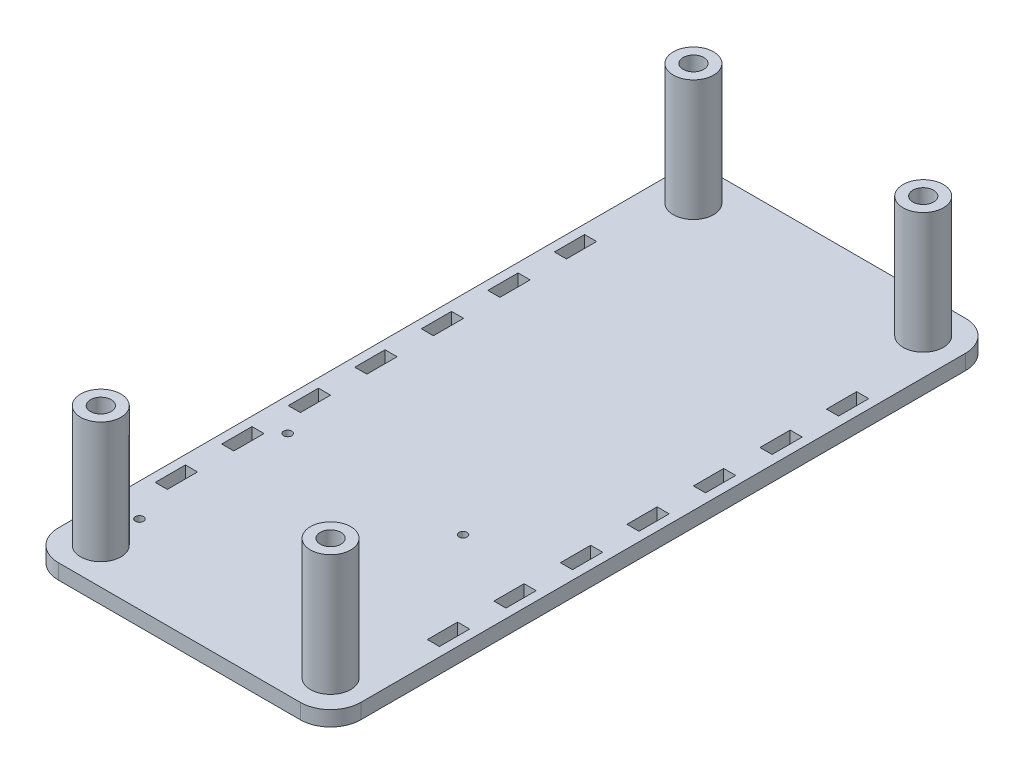
from build123d import *

# Parameters (mm, degrees)
SKETCH1_W           = 100
SKETCH1_H           = 220
BOSS_EXTRUDE1_DEPTH = 5
FILLET1_R           = 10
FILLET2_R           = 10
FILLET3_R           = 10
FILLET4_R           = 10
SKETCH2_R           = 6.668119003
BOSS_EXTRUDE2_DEPTH = 40
SKETCH4_R           = 3.418119003
CUT_EXTRUDE1_DEPTH  = 15
SKETCH5_R           = 3.418119003
CUT_EXTRUDE2_DEPTH  = 15
SKETCH6_R           = 3.418119003
CUT_EXTRUDE3_DEPTH  = 15
SKETCH7_R           = 3.418119003
CUT_EXTRUDE4_DEPTH  = 15
SKETCH8_W           = 4
SKETCH8_H           = 10
CUT_EXTRUDE5_DEPTH  = 157.908412776
SKETCH9_R           = 1.35
CUT_EXTRUDE7_DEPTH  = 159.256911381


with BuildPart() as part:
    # Sketch1 → Boss-Extrude1 (new body)
    with BuildSketch(Plane(origin=(0, 0, 0), x_dir=(1, 0, 0), z_dir=(0, 1, 0))):
        with Locations((-54.5, 0)):
            Rectangle(SKETCH1_W, SKETCH1_H)
    extrude(amount=BOSS_EXTRUDE1_DEPTH)

    # Fillet1
    fillet1_edges = [part.edges().sort_by_distance(p)[0] for p in [
        (-4.5, 2.5, 110),
    ]]
    fillet(fillet1_edges, radius=FILLET1_R)

    # Fillet2
    fillet2_edges = [part.edges().sort_by_distance(p)[0] for p in [
        (-4.5, 2.5, -110),
    ]]
    fillet(fillet2_edges, radius=FILLET2_R)

    # Fillet3
    fillet3_edges = [part.edges().sort_by_distance(p)[0] for p in [
        (-104.5, 2.5, 110),
    ]]
    fillet(fillet3_edges, radius=FILLET3_R)

    # Fillet4
    fillet4_edges = [part.edges().sort_by_distance(p)[0] for p in [
        (-104.5, 2.5, -110),
    ]]
    fillet(fillet4_edges, radius=FILLET4_R)

    # Sketch2 → Boss-Extrude2 (add)
    with BuildSketch(Plane(origin=(0, 5, 0), x_dir=(1, 0, 0), z_dir=(0, 1, 0))):
        with Locations(Location((-92.5, 98, 0), (0, 0, 270))):
            Circle(SKETCH2_R)
        with Locations(Location((-92.5, -98, 0), (0, 0, 90))):
            Circle(SKETCH2_R)
        with Locations(Location((-16.5, 98, 0), (0, 0, 90))):
            Circle(SKETCH2_R)
        with Locations(Location((-16.5, -98, 0), (0, 0, 270))):
            Circle(SKETCH2_R)
    extrude(amount=BOSS_EXTRUDE2_DEPTH)

    # Sketch4 → Cut-Extrude1 (cut)
    with BuildSketch(Plane(origin=(0, 45, 0), x_dir=(1, 0, 0), z_dir=(0, 1, 0))):
        with Locations(Location((-92.5, 98, 0), (0, 0, 270))):
            Circle(SKETCH4_R)
    extrude(amount=-CUT_EXTRUDE1_DEPTH, mode=Mode.SUBTRACT)

    # Sketch5 → Cut-Extrude2 (cut)
    with BuildSketch(Plane(origin=(0, 45, 0), x_dir=(1, 0, 0), z_dir=(0, 1, 0))):
        with Locations(Location((-92.5, -98, 0), (0, 0, 270))):
            Circle(SKETCH5_R)
    extrude(amount=-CUT_EXTRUDE2_DEPTH, mode=Mode.SUBTRACT)

    # Sketch6 → Cut-Extrude3 (cut)
    with BuildSketch(Plane(origin=(0, 45, 0), x_dir=(1, 0, 0), z_dir=(0, 1, 0))):
        with Locations(Location((-16.5, 98, 0), (0, 0, 270))):
            Circle(SKETCH6_R)
    extrude(amount=-CUT_EXTRUDE3_DEPTH, mode=Mode.SUBTRACT)

    # Sketch7 → Cut-Extrude4 (cut)
    with BuildSketch(Plane(origin=(0, 45, 0), x_dir=(1, 0, 0), z_dir=(0, 1, 0))):
        with Locations(Location((-16.5, -98, 0), (0, 0, 270))):
            Circle(SKETCH7_R)
    extrude(amount=-CUT_EXTRUDE4_DEPTH, mode=Mode.SUBTRACT)

    # Sketch8 → Cut-Extrude5 (cut, through all)
    with BuildSketch(Plane(origin=(0, 5, 0), x_dir=(1, 0, 0), z_dir=(0, 1, 0))):
        with Locations((-99.5, 66)):
            Rectangle(SKETCH8_W, SKETCH8_H)
        with Locations((-99.5, 44)):
            Rectangle(SKETCH8_W, SKETCH8_H)
        with Locations((-99.5, 22)):
            Rectangle(SKETCH8_W, SKETCH8_H)
        with Locations((-99.5, 0)):
            Rectangle(SKETCH8_W, SKETCH8_H)
        with Locations((-9.5, -66)):
            Rectangle(SKETCH8_W, SKETCH8_H)
        with Locations((-9.5, -44)):
            Rectangle(SKETCH8_W, SKETCH8_H)
        with Locations((-99.5, -22)):
            Rectangle(SKETCH8_W, SKETCH8_H)
        with Locations((-99.5, -44)):
            Rectangle(SKETCH8_W, SKETCH8_H)
        with Locations((-99.5, -66)):
            Rectangle(SKETCH8_W, SKETCH8_H)
        with Locations((-9.5, -22)):
            Rectangle(SKETCH8_W, SKETCH8_H)
        with Locations((-9.5, 0)):
            Rectangle(SKETCH8_W, SKETCH8_H)
        with Locations((-9.5, 22)):
            Rectangle(SKETCH8_W, SKETCH8_H)
        with Locations((-9.5, 44)):
            Rectangle(SKETCH8_W, SKETCH8_H)
        with Locations((-9.5, 66)):
            Rectangle(SKETCH8_W, SKETCH8_H)
    extrude(amount=-CUT_EXTRUDE5_DEPTH, mode=Mode.SUBTRACT)

    # Sketch9 → Cut-Extrude7 (cut, through all)
    with BuildSketch(Plane.XZ):
        with Locations(Location((-93.622758359, 35.073260268, 0), (0, 0, 270))):
            Circle(SKETCH9_R)
        with Locations(Location((-35.622758359, 35.073260268, 0), (0, 0, 270))):
            Circle(SKETCH9_R)
        with Locations(Location((-35.622758359, 84.073260268, 0), (0, 0, 270))):
            Circle(SKETCH9_R)
        with Locations(Location((-93.622758359, 84.073260268, 0), (0, 0, 270))):
            Circle(SKETCH9_R)
    extrude(amount=-CUT_EXTRUDE7_DEPTH, mode=Mode.SUBTRACT)


solid = part.part
